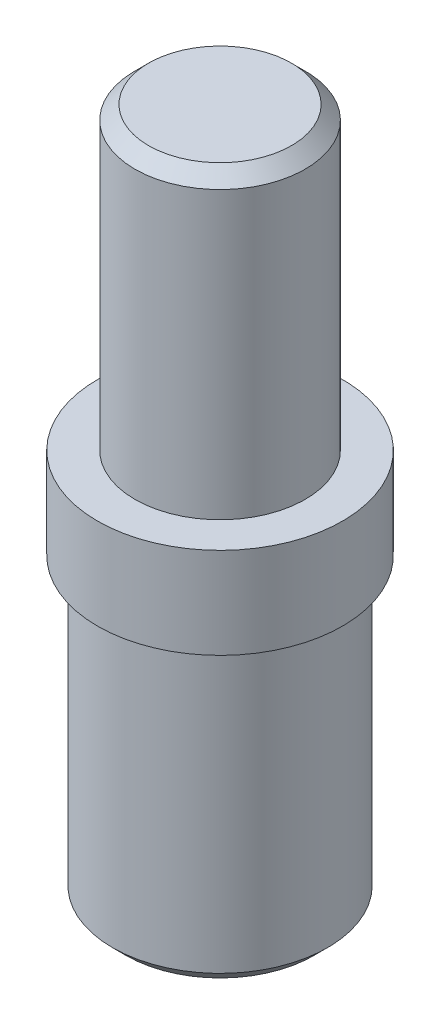
from build123d import *

# Parameters (mm, degrees)
SKETCH1_R           = 3.95
BOSS_EXTRUDE1_DEPTH = 11
SKETCH2_R           = 4.5
BOSS_EXTRUDE2_DEPTH = 3.34
SKETCH4_R           = 3.125
BOSS_EXTRUDE3_DEPTH = 11
CHAMFER1_SIZE       = 0.5


with BuildPart() as part:
    # Sketch1 → Boss-Extrude1 (new body)
    with BuildSketch(Plane(origin=(0, 0, 0), x_dir=(1, 0, 0), z_dir=(0, 1, 0))):
        with Locations(Location((0, 0, 0), (0, 0, 270))):
            Circle(SKETCH1_R)
    extrude(amount=BOSS_EXTRUDE1_DEPTH)

    # Sketch2 → Boss-Extrude2 (add)
    with BuildSketch(Plane(origin=(0, 11, 0), x_dir=(1, 0, 0), z_dir=(0, 1, 0))):
        with Locations(Location((0, 0, 0), (0, 0, 270))):
            Circle(SKETCH2_R)
    extrude(amount=BOSS_EXTRUDE2_DEPTH)

    # Sketch4 → Boss-Extrude3 (add)
    with BuildSketch(Plane(origin=(0, 14.34, 0), x_dir=(1, 0, 0), z_dir=(0, 1, 0))):
        with Locations(Location((0, 0, 0), (0, 0, 270))):
            Circle(SKETCH4_R)
    extrude(amount=BOSS_EXTRUDE3_DEPTH)

    # Chamfer1
    chamfer1_edges = [part.edges().sort_by_distance(p)[0] for p in [
        (0, 25.34, -3.125),
        (0, 0, -3.95),
    ]]
    chamfer(chamfer1_edges, length=CHAMFER1_SIZE)


solid = part.part
